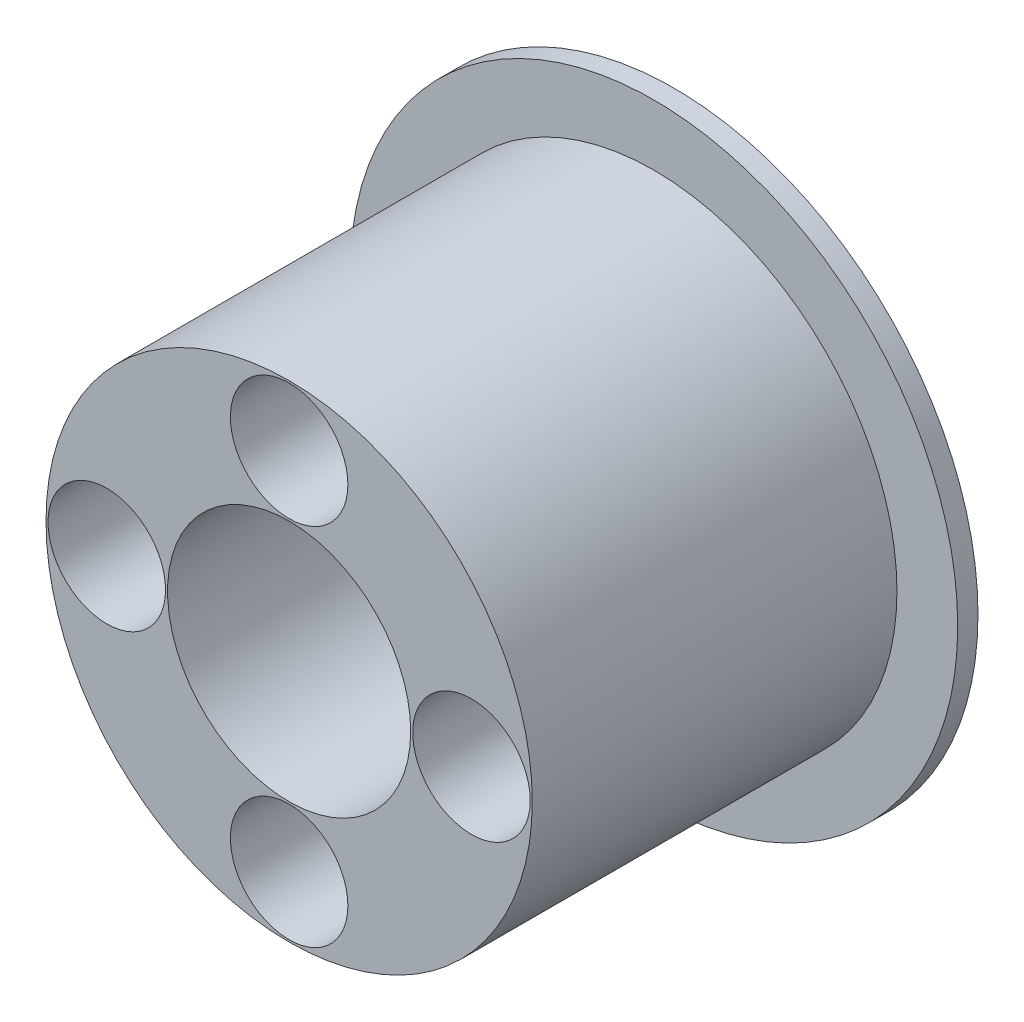
from build123d import *
from build123d.topology import SkipClean

# Parameters (mm, degrees)
SKIZZE1_R                       = 12
SKIZZE1_R_2                     = 1.5
AUFSATZ_LINEAR_AUSTRAGEN1_DEPTH = 18
AUFSATZ_LINEAR_START            = 1
SKIZZE4_R                       = 15
SKIZZE4_R_2                     = 1.5
AUFSATZ_LINEAR_AUSTRAGEN2_DEPTH = 1
SKIZZE2_R                       = 2.9
SCHNITT_LINEAR_AUSTRAGEN4_DEPTH = 14
SCHNITT_LINEAR_AUSTRAGEN5_DEPTH = 23
SKIZZE9_R                       = 2.5
SCHNITT_LINEAR_AUSTRAGEN7_DEPTH = 5
SKIZZE11_R                      = 6
SCHNITT_LINEAR_AUSTRAGEN9_DEPTH = 20


with BuildPart() as part:
    # Skizze1 → Aufsatz-Linear austragen1 (new body)
    with BuildSketch(Plane.XY):
        Circle(SKIZZE1_R)
        with Locations((9, 0)):
            Circle(SKIZZE1_R_2, mode=Mode.SUBTRACT)
        with Locations((0, -9)):
            Circle(SKIZZE1_R_2, mode=Mode.SUBTRACT)
        with Locations((-9, 0)):
            Circle(SKIZZE1_R_2, mode=Mode.SUBTRACT)
        with Locations((0, 9)):
            Circle(SKIZZE1_R_2, mode=Mode.SUBTRACT)
    extrude(amount=AUFSATZ_LINEAR_AUSTRAGEN1_DEPTH)

    # Skizze4 → Aufsatz-Linear austragen2 (add)
    with SkipClean():  # the faces are left unmerged after this step: merging them gives an invalid solid
        with BuildSketch(Plane(origin=(0, 0, 0), x_dir=(-1, 0, 0), z_dir=(0, 0, -1)).offset(AUFSATZ_LINEAR_START)):
            Circle(SKIZZE4_R)
            with Locations((0, 9)):
                Circle(SKIZZE4_R_2, mode=Mode.SUBTRACT)
            with Locations((9, 0)):
                Circle(SKIZZE4_R_2, mode=Mode.SUBTRACT)
            with Locations((0, -9)):
                Circle(SKIZZE4_R_2, mode=Mode.SUBTRACT)
            with Locations((-9, 0)):
                Circle(SKIZZE4_R_2, mode=Mode.SUBTRACT)
        extrude(amount=-AUFSATZ_LINEAR_AUSTRAGEN2_DEPTH)

    # Skizze2 → Schnitt-Linear austragen4 (cut)
    with BuildSketch(Plane.XY.offset(18)):
        with Locations((0, 9)):
            Circle(SKIZZE2_R)
        with Locations((9, 0)):
            Circle(SKIZZE2_R)
        with Locations((0, -9)):
            Circle(SKIZZE2_R)
        with Locations((-9, 0)):
            Circle(SKIZZE2_R)
    extrude(amount=-SCHNITT_LINEAR_AUSTRAGEN4_DEPTH, mode=Mode.SUBTRACT)

    # Skizze6 → Schnitt-Linear austragen5 (cut)
    with BuildSketch(Plane.XY.offset(18)):
        with BuildLine():
            Line((1.5, 2), (-1.5, 2))
            ThreePointArc((-1.5, 2), (-1.118033989, -2.236067977), (2.5, 0))
            ThreePointArc((2.5, 0), (2.236067977, 1.118033989), (1.5, 2))
        make_face()
    extrude(amount=-SCHNITT_LINEAR_AUSTRAGEN5_DEPTH, mode=Mode.SUBTRACT)

    # Skizze9 → Schnitt-Linear austragen7 (cut)
    with BuildSketch(Plane.XY.offset(18)):
        Circle(SKIZZE9_R)
    extrude(amount=-SCHNITT_LINEAR_AUSTRAGEN7_DEPTH, mode=Mode.SUBTRACT)

    # Skizze11 → Schnitt-Linear austragen9 (cut)
    with BuildSketch(Plane.XY.offset(18)):
        Circle(SKIZZE11_R)
    extrude(amount=-SCHNITT_LINEAR_AUSTRAGEN9_DEPTH, mode=Mode.SUBTRACT)


solid = part.part
